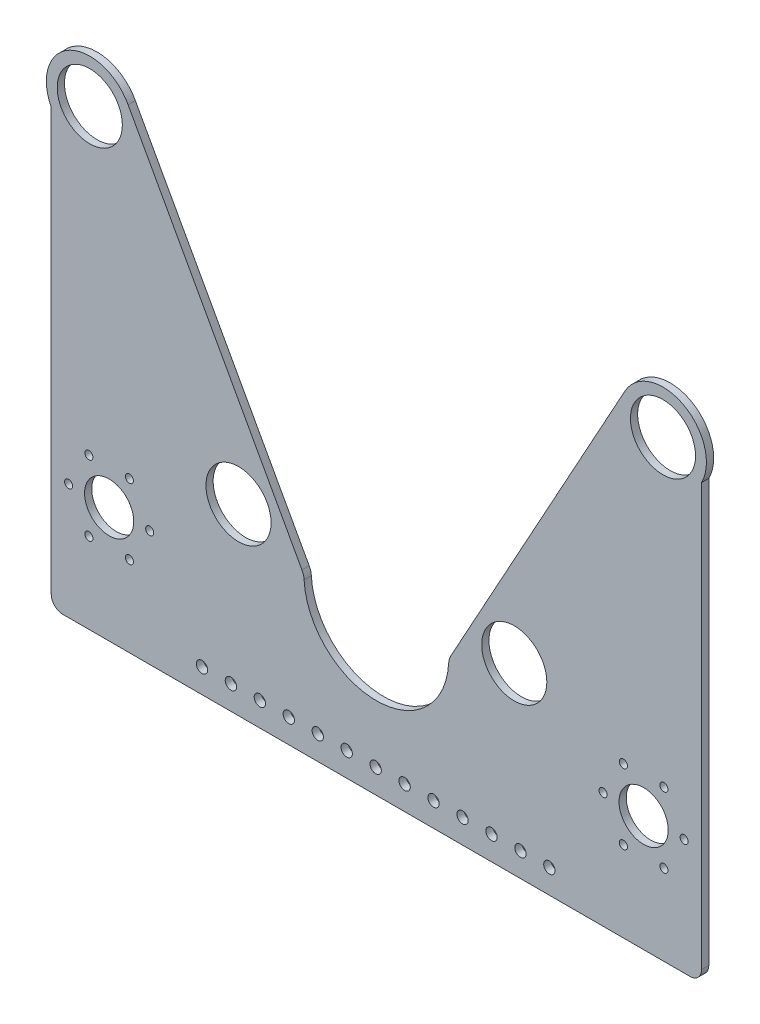
from build123d import *

# Parameters (mm, degrees)
SKETCH2_R           = 14.2875
SKETCH2_R_2         = 2.4892
SKETCH2_R_3         = 10.795
SKETCH2_R_4         = 1.778
BOSS_EXTRUDE1_DEPTH = 3.175
FILLET2_R           = 7.62


with BuildPart() as part:
    # Sketch2 → Boss-Extrude1 (new body)
    with BuildSketch(Plane.XY):
        with BuildLine():
            Line((142.632381685, 122.462939957), (142.632381685, -29.937060043))
            Line((142.632381685, -29.937060043), (142.632381685, -56.741928905))
            Line((142.632381685, -56.741928905), (142.632381685, -62.620500771))
            ThreePointArc((142.632381685, -62.620500771), (141.144484133, -66.21260322), (137.552381685, -67.700500771))
            Line((137.552381685, -67.700500771), (-137.552381685, -67.700500771))
            ThreePointArc((-137.552381685, -67.700500771), (-141.144484133, -66.21260322), (-142.632381685, -62.620500771))
            Line((-142.632381685, -62.620500771), (-142.632381685, -56.741928905))
            Line((-142.632381685, -56.741928905), (-142.632381685, -29.937060043))
            Line((-142.632381685, -29.937060043), (-142.632381685, 122.462939957))
            ThreePointArc((-142.632381685, 122.462939957), (-134.600001748, 148.101160684), (-108.918256202, 140.209048469))
            Line((-108.918256202, 140.209048469), (-31.75, 0))
            ThreePointArc((-31.75, 0), (0, -31.75), (31.75, 0))
            Line((31.75, 0), (108.918256202, 140.209048469))
            ThreePointArc((108.918256202, 140.209048469), (134.600001748, 148.101160684), (142.632381685, 122.462939957))
        make_face()
        with Locations((-60.484532313, 12.7)):
            Circle(SKETCH2_R, mode=Mode.SUBTRACT)
        with Locations((-125.726814921, 131.243846084)):
            Circle(SKETCH2_R, mode=Mode.SUBTRACT)
        with Locations((125.726814921, 131.243846084)):
            Circle(SKETCH2_R, mode=Mode.SUBTRACT)
        with Locations((60.484532313, 12.7)):
            Circle(SKETCH2_R, mode=Mode.SUBTRACT)
        with Locations((-76.5175, -57.15)):
            Circle(SKETCH2_R_2, mode=Mode.SUBTRACT)
        with Locations((-63.8175, -57.15)):
            Circle(SKETCH2_R_2, mode=Mode.SUBTRACT)
        with Locations((-51.1175, -57.15)):
            Circle(SKETCH2_R_2, mode=Mode.SUBTRACT)
        with Locations((-38.4175, -57.15)):
            Circle(SKETCH2_R_2, mode=Mode.SUBTRACT)
        with Locations((-25.7175, -57.15)):
            Circle(SKETCH2_R_2, mode=Mode.SUBTRACT)
        with Locations((-13.0175, -57.15)):
            Circle(SKETCH2_R_2, mode=Mode.SUBTRACT)
        with Locations((-0.3175, -57.15)):
            Circle(SKETCH2_R_2, mode=Mode.SUBTRACT)
        with Locations((12.3825, -57.15)):
            Circle(SKETCH2_R_2, mode=Mode.SUBTRACT)
        with Locations((25.0825, -57.15)):
            Circle(SKETCH2_R_2, mode=Mode.SUBTRACT)
        with Locations((37.7825, -57.15)):
            Circle(SKETCH2_R_2, mode=Mode.SUBTRACT)
        with Locations((50.4825, -57.15)):
            Circle(SKETCH2_R_2, mode=Mode.SUBTRACT)
        with Locations((63.1825, -57.15)):
            Circle(SKETCH2_R_2, mode=Mode.SUBTRACT)
        with Locations((75.8825, -57.15)):
            Circle(SKETCH2_R_2, mode=Mode.SUBTRACT)
        with Locations((-117.232381685, -16.900500771)):
            Circle(SKETCH2_R_3, mode=Mode.SUBTRACT)
        with Locations((117.232381685, -16.900500771)):
            Circle(SKETCH2_R_3, mode=Mode.SUBTRACT)
        with Locations((-135.012381685, -16.900500771)):
            Circle(SKETCH2_R_4, mode=Mode.SUBTRACT)
        with Locations((-126.122381685, -1.502569092)):
            Circle(SKETCH2_R_4, mode=Mode.SUBTRACT)
        with Locations((-108.342381685, -1.502569092)):
            Circle(SKETCH2_R_4, mode=Mode.SUBTRACT)
        with Locations((-99.452381685, -16.900500771)):
            Circle(SKETCH2_R_4, mode=Mode.SUBTRACT)
        with Locations((-108.342381685, -32.29843245)):
            Circle(SKETCH2_R_4, mode=Mode.SUBTRACT)
        with Locations((-126.122381685, -32.29843245)):
            Circle(SKETCH2_R_4, mode=Mode.SUBTRACT)
        with Locations((99.452381685, -16.900500771)):
            Circle(SKETCH2_R_4, mode=Mode.SUBTRACT)
        with Locations((108.342381685, -1.502569092)):
            Circle(SKETCH2_R_4, mode=Mode.SUBTRACT)
        with Locations((126.122381685, -1.502569092)):
            Circle(SKETCH2_R_4, mode=Mode.SUBTRACT)
        with Locations((135.012381685, -16.900500771)):
            Circle(SKETCH2_R_4, mode=Mode.SUBTRACT)
        with Locations((126.122381685, -32.29843245)):
            Circle(SKETCH2_R_4, mode=Mode.SUBTRACT)
        with Locations((108.342381685, -32.29843245)):
            Circle(SKETCH2_R_4, mode=Mode.SUBTRACT)
    extrude(amount=BOSS_EXTRUDE1_DEPTH)

    # Fillet2
    fillet2_edges = [part.edges().sort_by_distance(p)[0] for p in [
        (-31.75, 0, 1.5875),
        (31.75, 0, 1.5875),
    ]]
    fillet(fillet2_edges, radius=FILLET2_R)


solid = part.part
